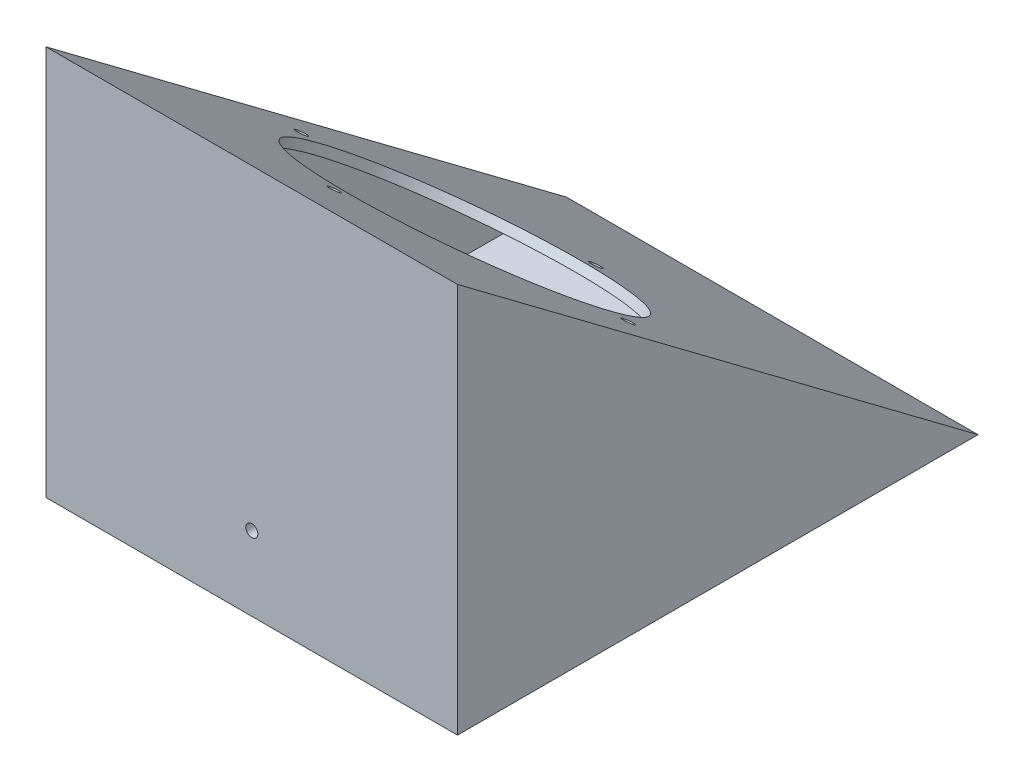
from build123d import *

# Parameters (mm, degrees)
BOSS_EXTRUDE1_DEPTH = 130
SKETCH2_R           = 48
CUT_EXTRUDE1_DEPTH  = 3
SKETCH3_R           = 1.9
CUT_EXTRUDE2_DEPTH  = 3
BOSS_EXTRUDE2_DEPTH = 3
BOSS_EXTRUDE3_DEPTH = 3
SKETCH6_R           = 2
CUT_EXTRUDE3_DEPTH  = 3


with BuildPart() as part:
    # Sketch1 → Boss-Extrude1 (new body)
    with BuildSketch(Plane(origin=(0, 0, 0), x_dir=(0, 0, -1), z_dir=(1, 0, 0))):
        Polygon((-3, 126), (169, -3), (-3, -3), align=None)
        Polygon((0, 0), (160, 0), (0, 120), align=None, mode=Mode.SUBTRACT)
    extrude(amount=BOSS_EXTRUDE1_DEPTH)

    # Sketch2 → Cut-Extrude1 (cut)
    with BuildSketch(Plane(origin=(0, 79.2, -59.4), x_dir=(1, 0, 0), z_dir=(0, 0.7999999999999998, -0.6000000000000002))):
        with Locations(Location((65, 10, 0), (0, 0, 270))):
            Circle(SKETCH2_R)
    extrude(amount=-CUT_EXTRUDE1_DEPTH, mode=Mode.SUBTRACT)

    # Sketch3 → Cut-Extrude2 (cut)
    with BuildSketch(Plane(origin=(0, 79.2, -59.4), x_dir=(1, 0, 0), z_dir=(0, 0.7999999999999998, -0.6000000000000002))):
        with Locations(Location((11, 10, 0), (0, 0, 270))):
            Circle(SKETCH3_R)
        with Locations(Location((65, -44, 0), (0, 0, 270))):
            Circle(SKETCH3_R)
        with Locations(Location((119, 10, 0), (0, 0, 270))):
            Circle(SKETCH3_R)
        with Locations(Location((65, 64, 0), (0, 0, 270))):
            Circle(SKETCH3_R)
    extrude(amount=-CUT_EXTRUDE2_DEPTH, mode=Mode.SUBTRACT)

    # Sketch4 → Boss-Extrude2 (add)
    with BuildSketch(Plane(origin=(130, 0, 0), x_dir=(0, 0, -1), z_dir=(1, 0, 0))):
        Polygon((-3, -3), (-3, 126), (169, -3), align=None)
    extrude(amount=BOSS_EXTRUDE2_DEPTH)

    # Sketch5 → Boss-Extrude3 (add)
    with BuildSketch(Plane.ZY):
        Polygon((3, 126), (3, -3), (-169, -3), align=None)
    extrude(amount=BOSS_EXTRUDE3_DEPTH)

    # Sketch6 → Cut-Extrude3 (cut)
    with BuildSketch(Plane.XY.offset(3)):
        with Locations((65, 21.56057542)):
            Circle(SKETCH6_R)
    extrude(amount=-CUT_EXTRUDE3_DEPTH, mode=Mode.SUBTRACT)


solid = part.part
